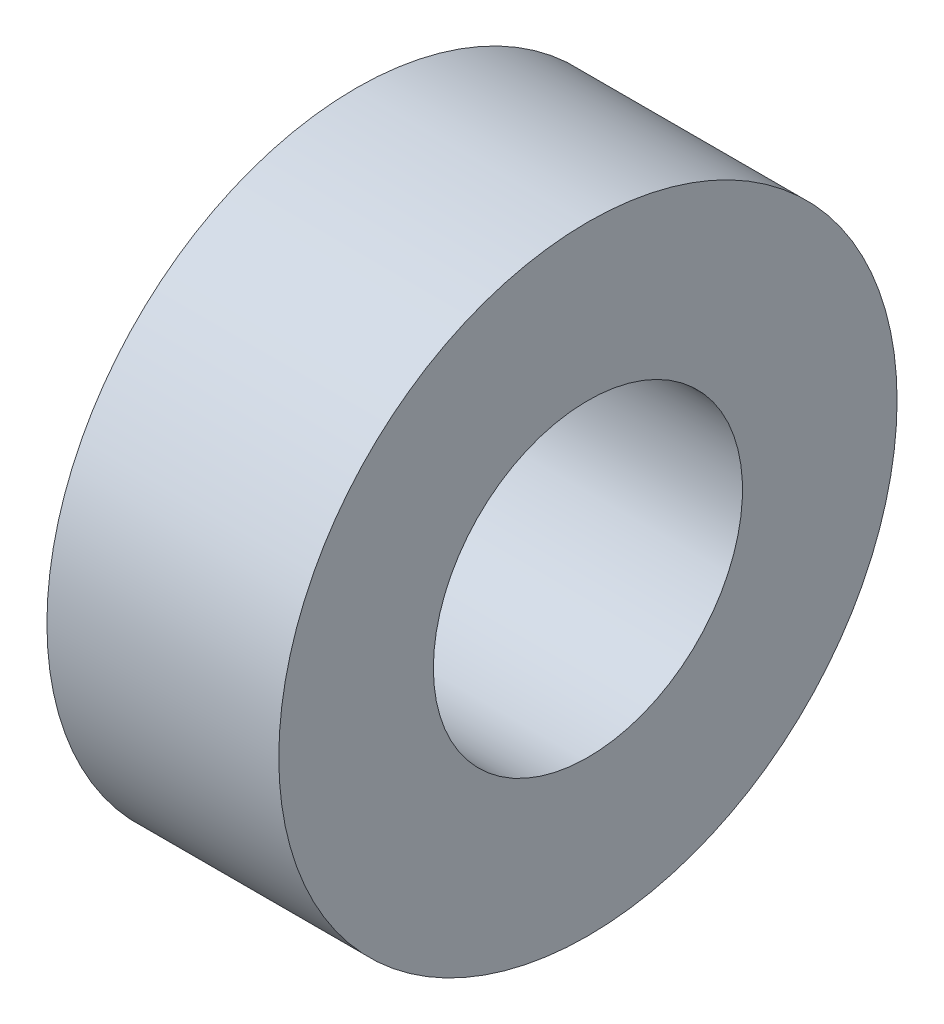
from build123d import *

# Parameters (mm, degrees)
SKETCH1_R           = 12.7
SKETCH1_R_2         = 6.35
BOSS_EXTRUDE1_DEPTH = 9.525


with BuildPart() as part:
    # Sketch1 → Boss-Extrude1 (new body)
    with BuildSketch(Plane(origin=(0, 0, 0), x_dir=(0, 0, -1), z_dir=(1, 0, 0))):
        with Locations(Location((0, 0, 0), (0, 0, 180))):
            Circle(SKETCH1_R)
        with Locations(Location((0, 0, 0), (0, 0, 180))):
            Circle(SKETCH1_R_2, mode=Mode.SUBTRACT)
    extrude(amount=BOSS_EXTRUDE1_DEPTH)


solid = part.part
